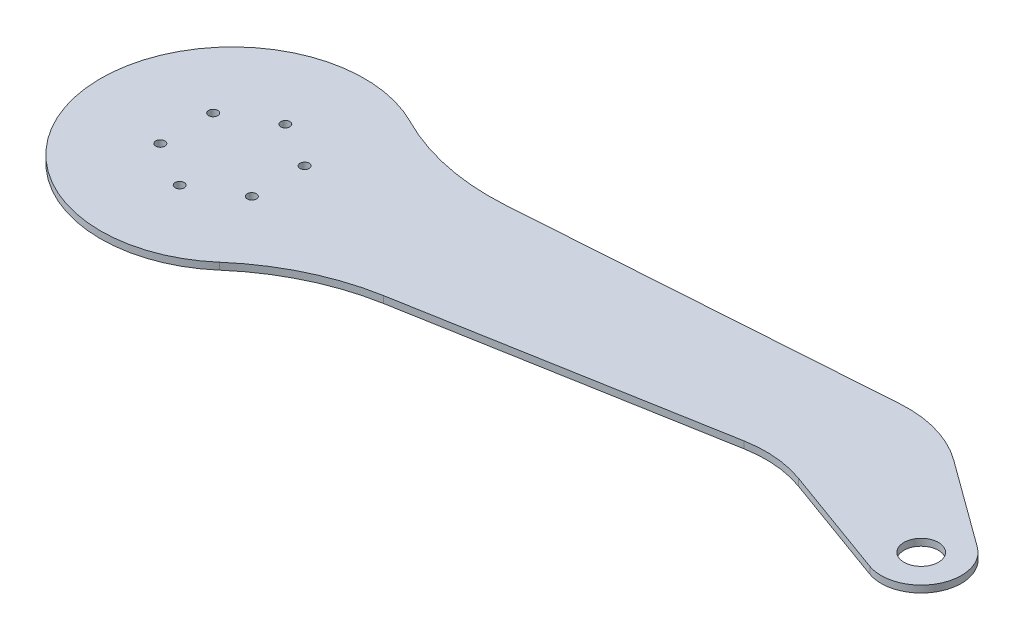
from build123d import *

# Parameters (mm, degrees)
SKETCH1_R           = 2
SKETCH1_R_2         = 7.5
BOSS_EXTRUDE2_DEPTH = 3
FILLET1_R           = 50
FILLET2_R           = 100


with BuildPart() as part:
    # Sketch1 → Boss-Extrude2 (new body)
    with BuildSketch(Plane(origin=(0, 0, 0), x_dir=(1, 0, 0), z_dir=(0, 1, 0))):
        with BuildLine():
            Line((257.543524338, 52.623283), (43.136797408, 38.01929391))
            ThreePointArc((43.136797408, 38.01929391), (-57.072915612, -6.99516287), (51.041719813, -26.476269347))
            Line((51.041719813, -26.476269347), (232.634460204, 5.800541986))
            Line((232.634460204, 5.800541986), (294.037229007, -16.452822314))
            ThreePointArc((294.037229007, -16.452822314), (315.449808374, -8.21908883), (310.311776158, 14.139210461))
            Line((310.311776158, 14.139210461), (257.543524338, 52.623283))
        make_face()
        with Locations(Location((19.918584287, 11.5, 0), (0, 0, 270))):
            Circle(SKETCH1_R, mode=Mode.SUBTRACT)
        with Locations(Location((-19.918584287, 11.5, 0), (0, 0, 270))):
            Circle(SKETCH1_R, mode=Mode.SUBTRACT)
        with Locations(Location((0, 23, 0), (0, 0, 270))):
            Circle(SKETCH1_R, mode=Mode.SUBTRACT)
        with Locations(Location((0, -23, 0), (0, 0, 270))):
            Circle(SKETCH1_R, mode=Mode.SUBTRACT)
        with Locations(Location((-19.918584287, -11.5, 0), (0, 0, 270))):
            Circle(SKETCH1_R, mode=Mode.SUBTRACT)
        with Locations(Location((19.918584287, -11.5, 0), (0, 0, 270))):
            Circle(SKETCH1_R, mode=Mode.SUBTRACT)
        with Locations(Location((300, 0, 0), (0, 0, 270))):
            Circle(SKETCH1_R_2, mode=Mode.SUBTRACT)
    extrude(amount=BOSS_EXTRUDE2_DEPTH)

    # Fillet1
    fillet1_edges = [part.edges().sort_by_distance(p)[0] for p in [
        (232.634460204, 1.5, -5.800541986),
        (257.543524338, 1.5, -52.623283),
    ]]
    fillet(fillet1_edges, radius=FILLET1_R)

    # Fillet2
    fillet2_edges = [part.edges().sort_by_distance(p)[0] for p in [
        (51.041719813, 1.5, 26.476269347),
        (43.136797408, 1.5, -38.01929391),
    ]]
    fillet(fillet2_edges, radius=FILLET2_R)


solid = part.part
